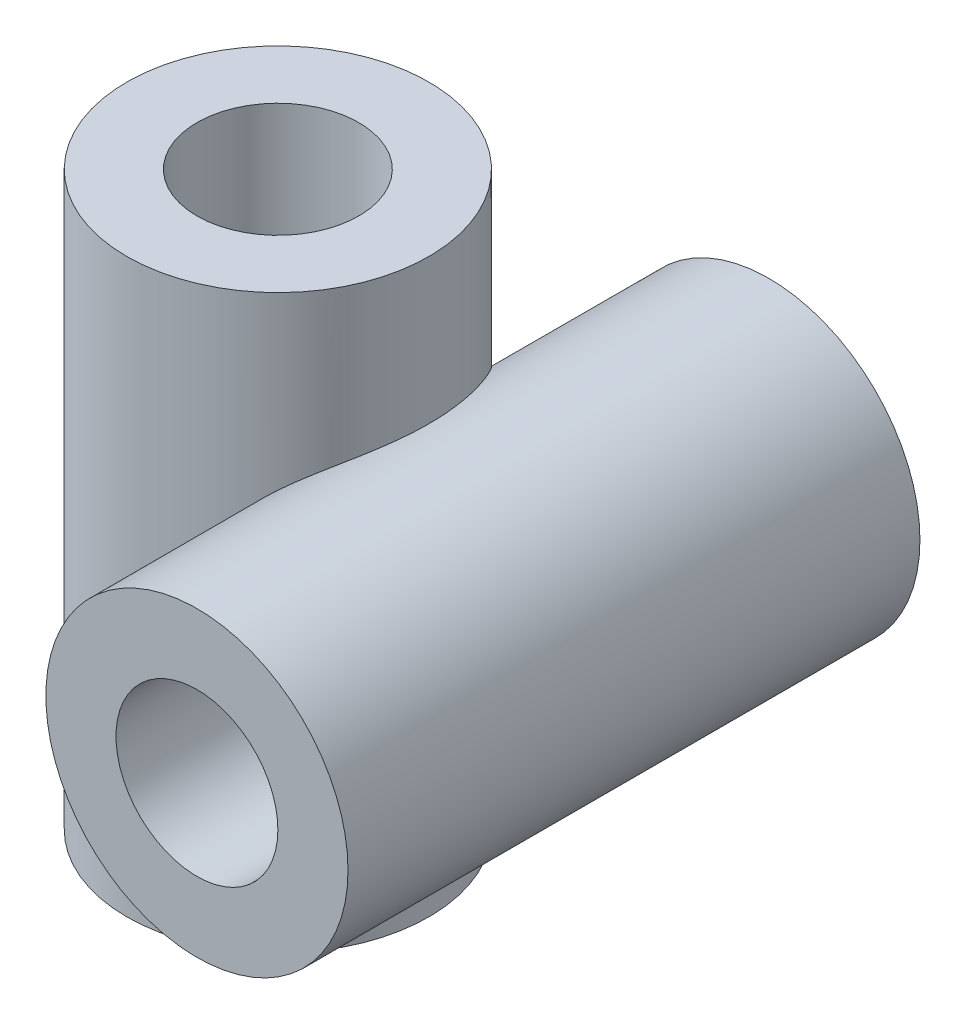
from build123d import *

# Parameters (mm, degrees)
SKETCH1_R           = 28
SKETCH1_R_2         = 15
BOSS_EXTRUDE1_DEPTH = 53
SKETCH2_R           = 28
SKETCH2_R_2         = 15
BOSS_EXTRUDE2_DEPTH = 53
SKETCH3_R           = 15
CUT_EXTRUDE1_DEPTH  = 136.650285827
SCALE1_SCALE        = 0.3


with BuildPart() as part:
    # Sketch1 → Boss-Extrude1 (new, symmetric)
    with BuildSketch(Plane.XY):
        Circle(SKETCH1_R)
        Circle(SKETCH1_R_2, mode=Mode.SUBTRACT)
    extrude(amount=BOSS_EXTRUDE1_DEPTH, both=True)

    # Sketch2 → Boss-Extrude2 (add, symmetric)
    with BuildSketch(Plane(origin=(0, 0, 0), x_dir=(1, 0, 0), z_dir=(0, 1, 0))):
        with Locations(Location((-38, 0, 0), (0, 0, 270))):
            Circle(SKETCH2_R)
        with Locations(Location((-38, 0, 0), (0, 0, 270))):
            Circle(SKETCH2_R_2, mode=Mode.SUBTRACT)
    extrude(amount=BOSS_EXTRUDE2_DEPTH, both=True)

    # Sketch3 → Cut-Extrude1 (cut, through all)
    with BuildSketch(Plane(origin=(0, 53, 0), x_dir=(1, 0, 0), z_dir=(0, 1, 0))):
        with Locations(Location((-38, 0, 0), (0, 0, 270))):
            Circle(SKETCH3_R)
    extrude(amount=-CUT_EXTRUDE1_DEPTH, mode=Mode.SUBTRACT)


with BuildPart() as part_1:
    # Scale1: scaled about (-18.971831543, 0.000154548, 3.0881e-05)
    add(part.part.scale(SCALE1_SCALE).moved(Location((-13.28028208, 0.000108184, 2.1617e-05))))


solid = part_1.part
